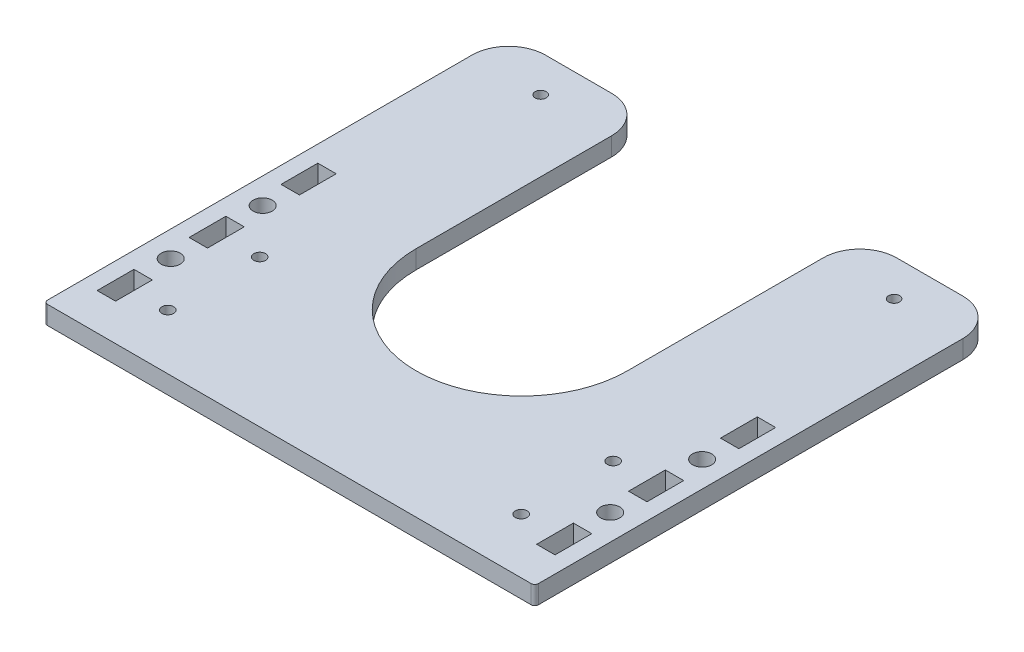
from build123d import *

# Parameters (mm, degrees)
SKETCH1_W           = 133.5
SKETCH1_H           = 126.4
SKETCH1_R           = 2.6
SKETCH1_R_2         = 1.6
SKETCH1_W_2         = 5
SKETCH1_H_2         = 10
BOSS_EXTRUDE1_DEPTH = 5
CUT_EXTRUDE2_DEPTH  = 10
FILLET2_R           = 10
CUT_EXTRUDE3_REACH  = 94.059
SKETCH5_R           = 1.6
SKETCH5_R_2         = 1.5
FILLET3_R           = 1


with BuildPart() as part:
    # Sketch1 → Boss-Extrude1 (new body)
    with BuildSketch(Plane(origin=(0, 0, 0), x_dir=(1, 0, 0), z_dir=(0, 1, 0))):
        Rectangle(SKETCH1_W, SKETCH1_H)
        with Locations(Location((-59.75, -35.7, 0), (0, 0, 270))):
            Circle(SKETCH1_R, mode=Mode.SUBTRACT)
        with Locations(Location((59.75, -35.7, 0), (0, 0, 90))):
            Circle(SKETCH1_R, mode=Mode.SUBTRACT)
        with Locations(Location((-48.05, -48.2, 0), (0, 0, 270))):
            Circle(SKETCH1_R_2, mode=Mode.SUBTRACT)
        with Locations(Location((48.05, -48.2, 0), (0, 0, 90))):
            Circle(SKETCH1_R_2, mode=Mode.SUBTRACT)
        with Locations(Location((-59.75, -10.7, 0), (0, 0, 90))):
            Circle(SKETCH1_R, mode=Mode.SUBTRACT)
        with Locations(Location((59.75, -10.7, 0), (0, 0, 270))):
            Circle(SKETCH1_R, mode=Mode.SUBTRACT)
        with Locations((-59.75, -48.2)):
            Rectangle(SKETCH1_W_2, SKETCH1_H_2, mode=Mode.SUBTRACT)
        with Locations((-59.75, -23.2)):
            Rectangle(SKETCH1_W_2, SKETCH1_H_2, mode=Mode.SUBTRACT)
        with Locations((59.75, -23.2)):
            Rectangle(SKETCH1_W_2, SKETCH1_H_2, mode=Mode.SUBTRACT)
        with Locations((59.75, -48.2)):
            Rectangle(SKETCH1_W_2, SKETCH1_H_2, mode=Mode.SUBTRACT)
        with Locations((-59.75, 1.8)):
            Rectangle(SKETCH1_W_2, SKETCH1_H_2, mode=Mode.SUBTRACT)
        with Locations((59.75, 1.8)):
            Rectangle(SKETCH1_W_2, SKETCH1_H_2, mode=Mode.SUBTRACT)
    extrude(amount=BOSS_EXTRUDE1_DEPTH)

    # Sketch2 → Cut-Extrude2 (cut)
    with BuildSketch(Plane(origin=(0, 5, 0), x_dir=(1, 0, 0), z_dir=(0, 1, 0))):
        with BuildLine():
            Line((-28.75, 86.678700037), (-28.75, 0))
            ThreePointArc((-28.75, 0), (0, -28.75), (28.75, 0))
            Line((28.75, 0), (28.75, 86.678700037))
            Line((28.75, 86.678700037), (-28.75, 86.678700037))
        make_face()
    extrude(amount=-CUT_EXTRUDE2_DEPTH, mode=Mode.SUBTRACT)

    # Fillet2
    fillet2_edges = [part.edges().sort_by_distance(p)[0] for p in [
        (-28.75, 2.5, -63.2),
        (28.75, 2.5, -63.2),
        (-66.75, 2.5, -63.2),
        (66.75, 2.5, -63.2),
    ]]
    fillet(fillet2_edges, radius=FILLET2_R)

    # Sketch5 → Cut-Extrude3 (cut, up to next)
    with BuildSketch(Plane.XZ, mode=Mode.PRIVATE) as cut_extrude3_sk1:
        with Locations(Location((48.05, 23.2, 0), (0, 0, 270))):
            Circle(SKETCH5_R)
    cut_extrude3_tool1 = extrude(cut_extrude3_sk1.sketch, amount=-CUT_EXTRUDE3_REACH, mode=Mode.PRIVATE) & part.part
    # Sketch5 → Cut-Extrude3 (cut, up to next)
    with BuildSketch(Plane.XZ, mode=Mode.PRIVATE) as cut_extrude3_sk2:
        with Locations(Location((48.05, -53.2, 0), (0, 0, 270))):
            Circle(SKETCH5_R_2)
    cut_extrude3_tool2 = extrude(cut_extrude3_sk2.sketch, amount=-CUT_EXTRUDE3_REACH, mode=Mode.PRIVATE) & part.part
    # Sketch5 → Cut-Extrude3 (cut, up to next)
    with BuildSketch(Plane.XZ, mode=Mode.PRIVATE) as cut_extrude3_sk3:
        with Locations(Location((-48.05, -53.2, 0), (0, 0, 90))):
            Circle(SKETCH5_R_2)
    cut_extrude3_tool3 = extrude(cut_extrude3_sk3.sketch, amount=-CUT_EXTRUDE3_REACH, mode=Mode.PRIVATE) & part.part
    # Sketch5 → Cut-Extrude3 (cut, up to next)
    with BuildSketch(Plane.XZ, mode=Mode.PRIVATE) as cut_extrude3_sk4:
        with Locations(Location((-48.05, 23.2, 0), (0, 0, 90))):
            Circle(SKETCH5_R)
    cut_extrude3_tool4 = extrude(cut_extrude3_sk4.sketch, amount=-CUT_EXTRUDE3_REACH, mode=Mode.PRIVATE) & part.part
    add(cut_extrude3_tool1.solids().sort_by_distance((48.05, 0, 23.2))[0], mode=Mode.SUBTRACT)
    add(cut_extrude3_tool2.solids().sort_by_distance((48.05, 0, -53.2))[0], mode=Mode.SUBTRACT)
    add(cut_extrude3_tool3.solids().sort_by_distance((-48.05, 0, -53.2))[0], mode=Mode.SUBTRACT)
    add(cut_extrude3_tool4.solids().sort_by_distance((-48.05, 0, 23.2))[0], mode=Mode.SUBTRACT)

    # Fillet3
    fillet3_edges = [part.edges().sort_by_distance(p)[0] for p in [
        (66.75, 2.5, 63.2),
        (-66.75, 2.5, 63.2),
    ]]
    fillet(fillet3_edges, radius=FILLET3_R)


solid = part.part
